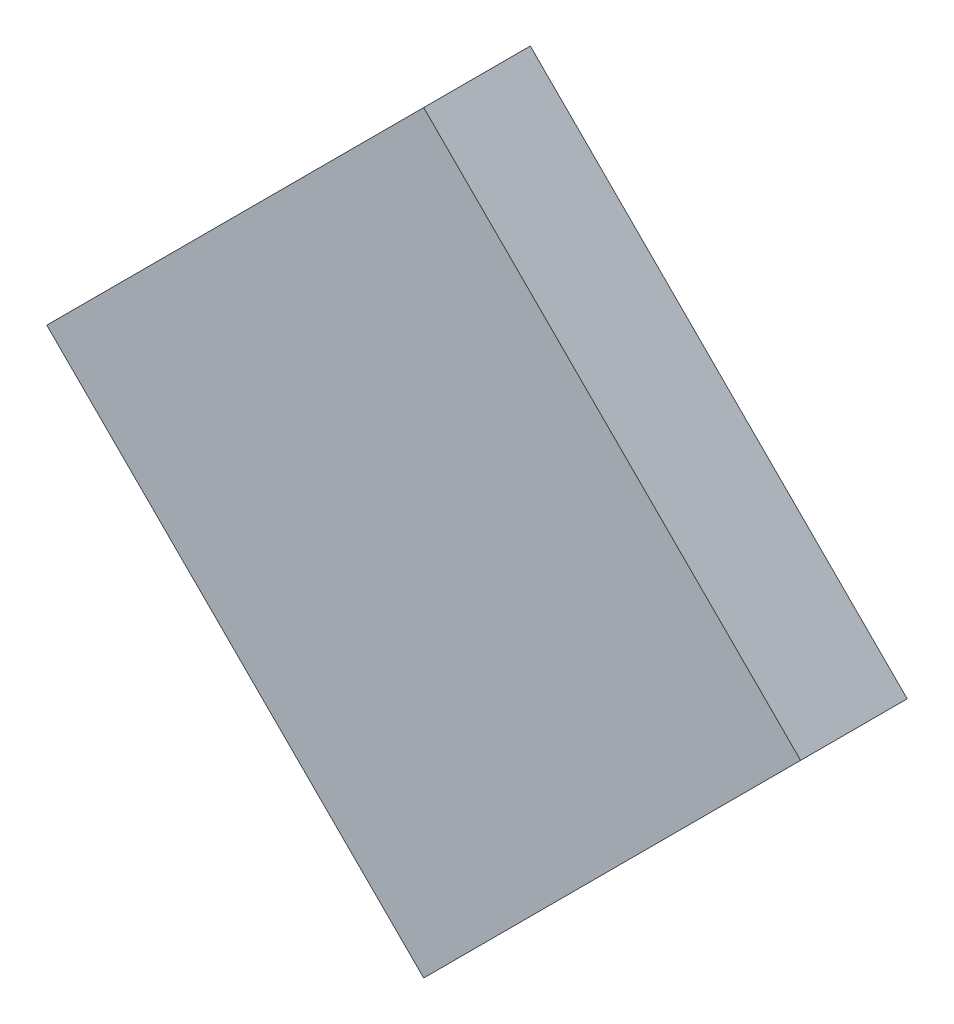
from build123d import *

# Parameters (mm, degrees)
BOSS_EXTRUDE1_DEPTH = 12


with BuildPart() as part:
    # Sketch1 → Boss-Extrude1 (new body)
    with BuildSketch(Plane.XY):
        Polygon((-42.426406871, 0), (0, -42.426406871), (42.426406871, 0), (0, 42.426406871), align=None)
    extrude(amount=BOSS_EXTRUDE1_DEPTH)


solid = part.part
